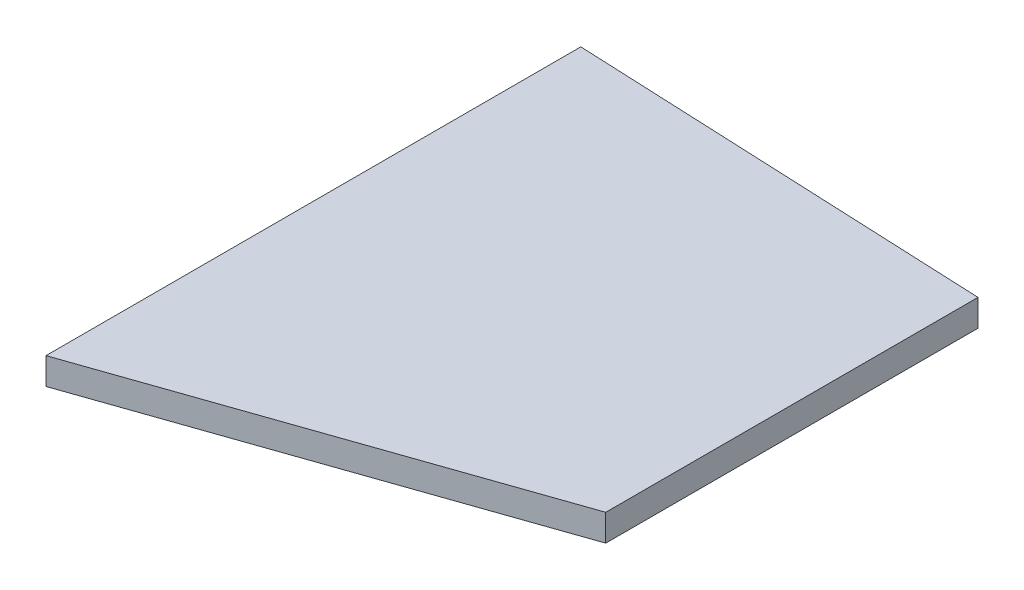
from build123d import *

# Parameters (mm, degrees)
BOSS_EXTRUDE1_DEPTH = 5.715


with BuildPart() as part:
    # Sketch1 → Boss-Extrude1 (new body)
    with BuildSketch(Plane(origin=(0, 0, 0), x_dir=(1, 0, 0), z_dir=(0, 1, 0))):
        Polygon((107.95, 16.763624127), (107.95, 0), (196.763193544, 30.815103758), (196.763193544, 110.372322254), (107.95, 114.3), (107.95, 104.11377721), (107.95, 91.670448695), (107.95, 79.815928293), (107.95, 67.961407891), (107.95, 54.217036411), (107.95, 43.736953157), (107.95, 28.274535242), align=None)
    extrude(amount=BOSS_EXTRUDE1_DEPTH)


solid = part.part
